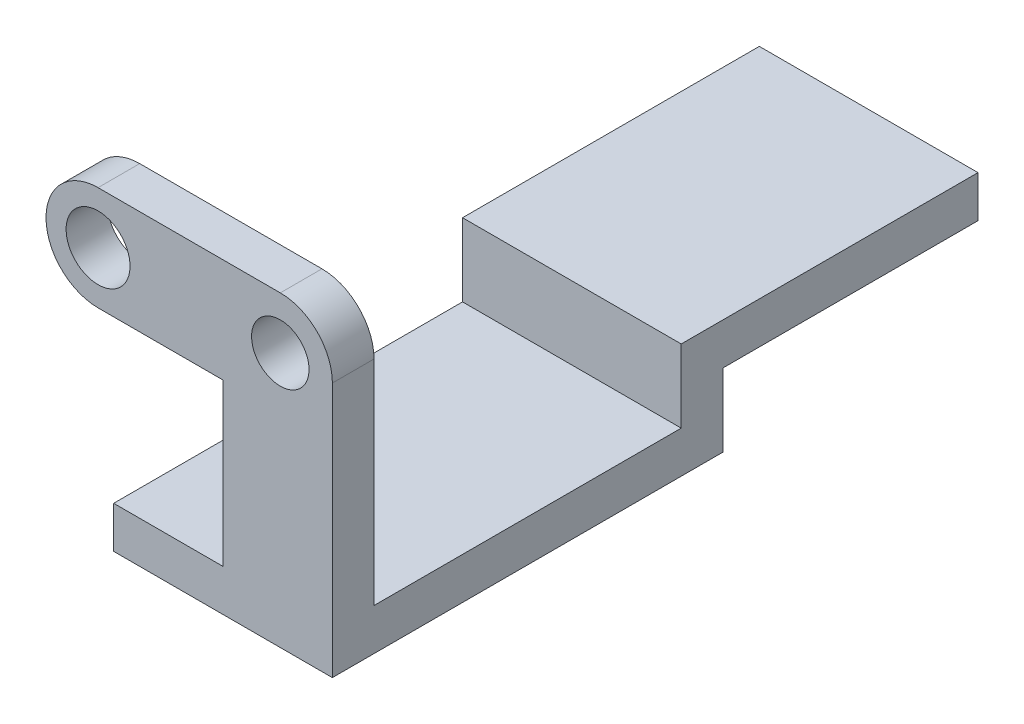
from build123d import *

# Parameters (mm, degrees)
BOSS_EXTRUDE1_DEPTH     = 42
SKETCH11_W              = 42
SKETCH11_H              = 16
BOSS_EXTRUDE2_DEPTH     = 82
BOSS_EXTRUDE4_DEPTH     = 16
CUT_EXTRUDE2_DEPTH      = 270.02044532
CUT_EXTRUDE2_DEPTH_BACK = 270.02044532
SKETCH17_R              = 11.03433716
SKETCH17_R_2            = 12.280198215


with BuildPart() as part:
    # Sketch10 → Boss-Extrude1 (new, symmetric)
    with BuildSketch(Plane(origin=(0, 0, 0), x_dir=(0, 0, -1), z_dir=(1, 0, 0))):
        Polygon((-150, 0), (0, 0), (0, 28), (98, 28), (98, 44), (-16, 44), (-16, 16), (-150, 16), align=None)
    extrude(amount=BOSS_EXTRUDE1_DEPTH, both=True)

    # Sketch11 → Boss-Extrude2 (add)
    with BuildSketch(Plane(origin=(0, 16, 0), x_dir=(1, 0, 0), z_dir=(0, 1, 0))):
        with Locations((21, -142)):
            Rectangle(SKETCH11_W, SKETCH11_H)
    extrude(amount=BOSS_EXTRUDE2_DEPTH)

    # Sketch12 → Boss-Extrude4 (add)
    with BuildSketch(Plane.XY.offset(150)):
        with BuildLine():
            Line((-48, 118), (22, 118))
            ThreePointArc((22, 118), (42, 98), (22, 78))
            Line((22, 78), (-48, 78))
            ThreePointArc((-48, 78), (-68, 98), (-48, 118))
        make_face()
    extrude(amount=-BOSS_EXTRUDE4_DEPTH)

    # Sketch17 → Cut-Extrude2 (cut, two sides: drawn at the far end of the back side and taken through both)
    with BuildSketch(Plane(origin=(0, 0, 134), x_dir=(-1, 0, 0), z_dir=(0, 0, -1)).offset(-CUT_EXTRUDE2_DEPTH_BACK)):
        with Locations(Location((-22, 98, 0), (0, 0, 90))):
            Circle(SKETCH17_R)
        with Locations(Location((48, 98, 0), (0, 0, 90))):
            Circle(SKETCH17_R_2)
    extrude(amount=CUT_EXTRUDE2_DEPTH + CUT_EXTRUDE2_DEPTH_BACK, mode=Mode.SUBTRACT)


solid = part.part
